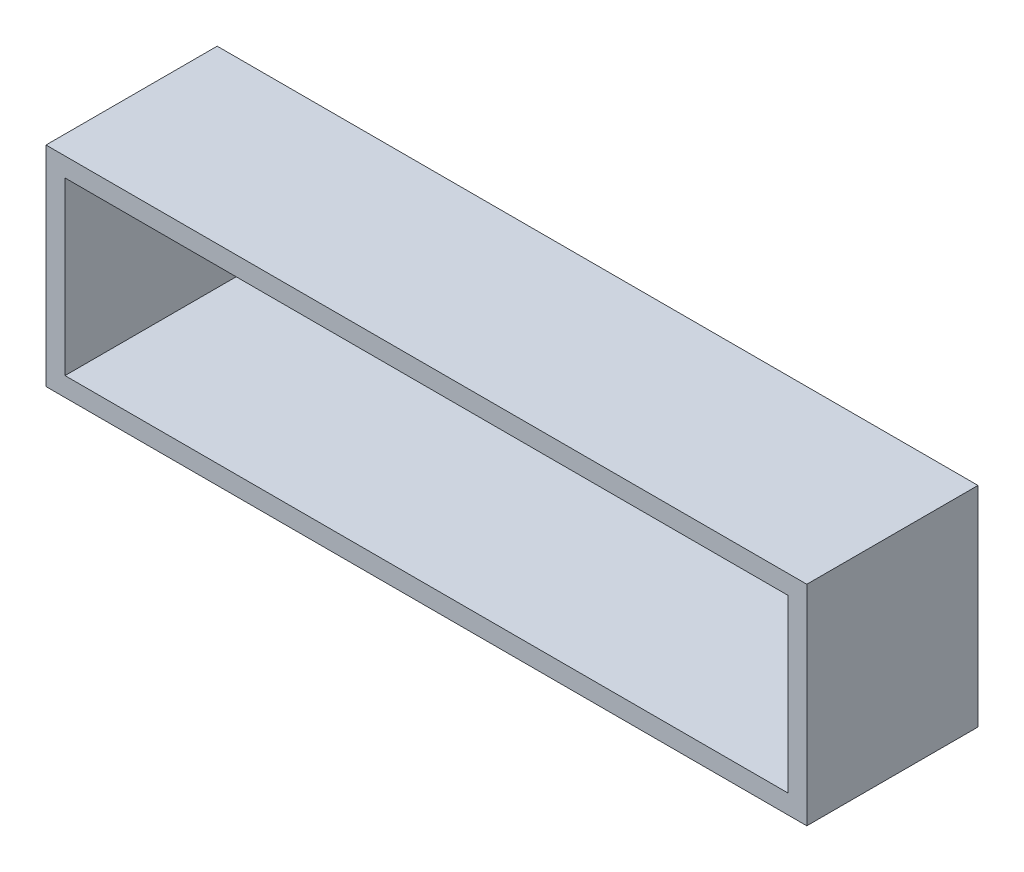
from build123d import *

# Parameters (mm, degrees)
SKETCH1_W               = 200
SKETCH1_H               = 45
BOSS_EXTRUDE1_DEPTH     = 55
CUT_EXTRUDE1_DEPTH      = 213.249852768
CUT_EXTRUDE1_DEPTH_BACK = 213.249852768
SKETCH2_W               = 190
SKETCH2_H               = 45


with BuildPart() as part:
    # Sketch1 → Boss-Extrude1 (new body)
    with BuildSketch(Plane(origin=(0, 0, 0), x_dir=(1, 0, 0), z_dir=(0, 1, 0))):
        with Locations((100, 22.5)):
            Rectangle(SKETCH1_W, SKETCH1_H)
    extrude(amount=BOSS_EXTRUDE1_DEPTH)

    # Sketch2 → Cut-Extrude1 (cut, two sides: drawn at the far end of the back side and taken through both)
    with BuildSketch(Plane.XY.offset(-CUT_EXTRUDE1_DEPTH_BACK)):
        with Locations((100, 27.5)):
            Rectangle(SKETCH2_W, SKETCH2_H)
    extrude(amount=CUT_EXTRUDE1_DEPTH + CUT_EXTRUDE1_DEPTH_BACK, mode=Mode.SUBTRACT)


solid = part.part
